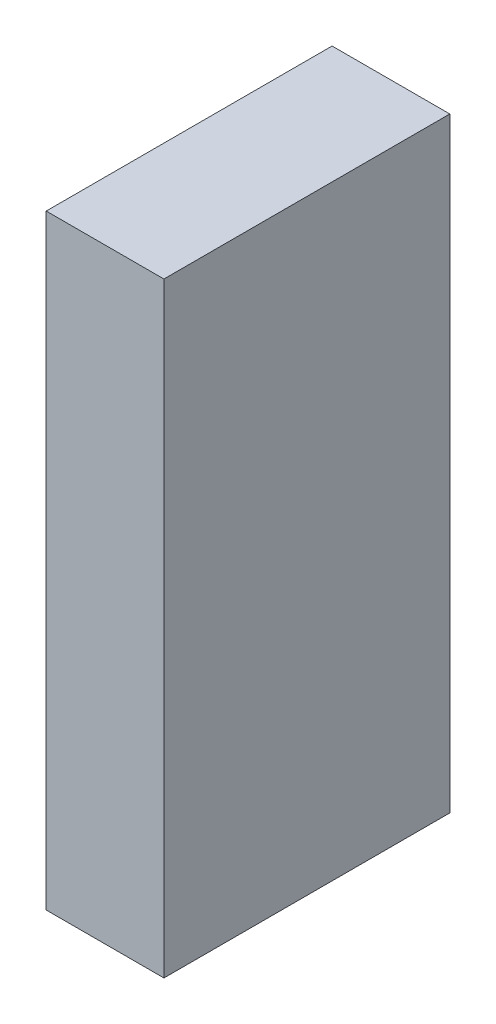
from build123d import *

# Parameters (mm, degrees)
CROQUIS1_W              = 14
CROQUIS1_H              = 34
SALIENTE_EXTRUIR1_DEPTH = 72


with BuildPart() as part:
    # Croquis1 → Saliente-Extruir1 (new body)
    with BuildSketch(Plane(origin=(0, 0, 0), x_dir=(1, 0, 0), z_dir=(0, 1, 0))):
        with Locations((0.933085502, 7.962825279)):
            Rectangle(CROQUIS1_W, CROQUIS1_H)
    extrude(amount=SALIENTE_EXTRUIR1_DEPTH)


solid = part.part
